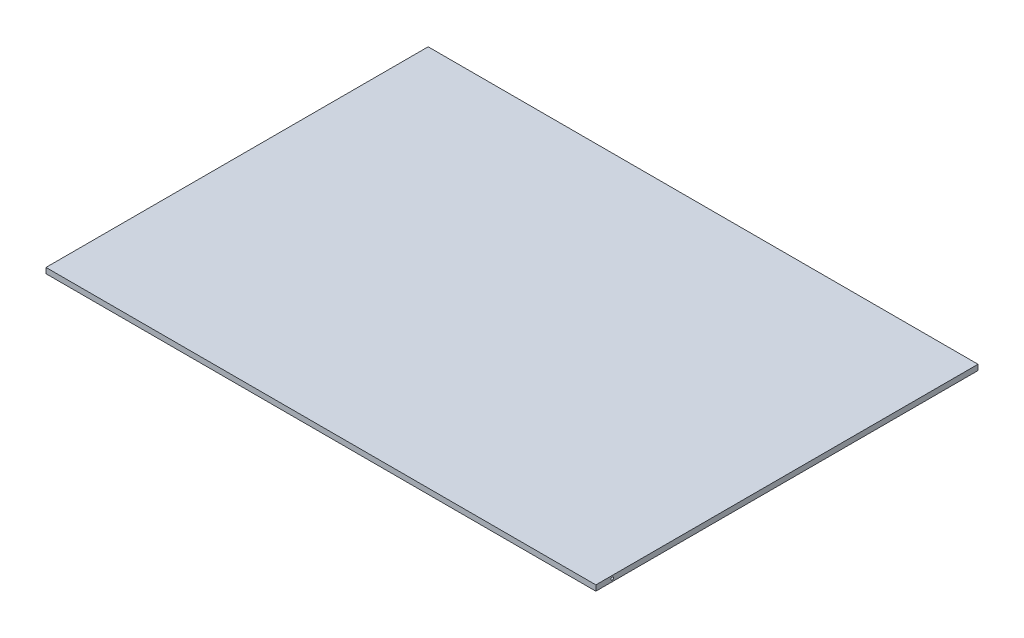
from build123d import *

# Parameters (mm, degrees)
SKETCH1_W           = 200
SKETCH1_H           = 134
BOSS_EXTRUDE1_DEPTH = 2
SKETCH2_R           = 0.5
CUT_EXTRUDE1_DEPTH  = 211.933638854
SKETCH3_W           = 200
SKETCH3_H           = 2
BOSS_EXTRUDE2_DEPTH = 5


with BuildPart() as part:
    # Sketch1 → Boss-Extrude1 (new body)
    with BuildSketch(Plane(origin=(0, 0, 0), x_dir=(1, 0, 0), z_dir=(0, 1, 0))):
        Rectangle(SKETCH1_W, SKETCH1_H)
    extrude(amount=BOSS_EXTRUDE1_DEPTH)

    # Sketch2 → Cut-Extrude1 (cut, through all)
    with BuildSketch(Plane(origin=(100, 0, 0), x_dir=(0, 0, -1), z_dir=(1, 0, 0))):
        with Locations((-66, 1)):
            Circle(SKETCH2_R)
    extrude(amount=-CUT_EXTRUDE1_DEPTH, mode=Mode.SUBTRACT)

    # Sketch3 → Boss-Extrude2 (add)
    with BuildSketch(Plane.XY.offset(67)):
        with Locations((0, 1)):
            Rectangle(SKETCH3_W, SKETCH3_H)
    extrude(amount=BOSS_EXTRUDE2_DEPTH)


solid = part.part
